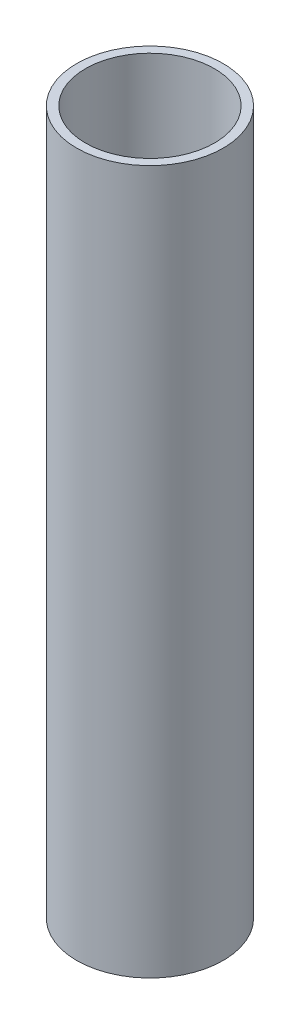
from build123d import *

# Parameters (mm, degrees)
SKETCH1_R           = 12.5
SKETCH1_R_2         = 11
BOSS_EXTRUDE1_DEPTH = 120


with BuildPart() as part:
    # Sketch1 → Boss-Extrude1 (new body)
    with BuildSketch(Plane(origin=(0, 0, 0), x_dir=(1, 0, 0), z_dir=(0, 1, 0))):
        with Locations(Location((0, 0, 0), (0, 0, 270))):
            Circle(SKETCH1_R)
        with Locations(Location((0, 0, 0), (0, 0, 270))):
            Circle(SKETCH1_R_2, mode=Mode.SUBTRACT)
    extrude(amount=BOSS_EXTRUDE1_DEPTH)


solid = part.part
